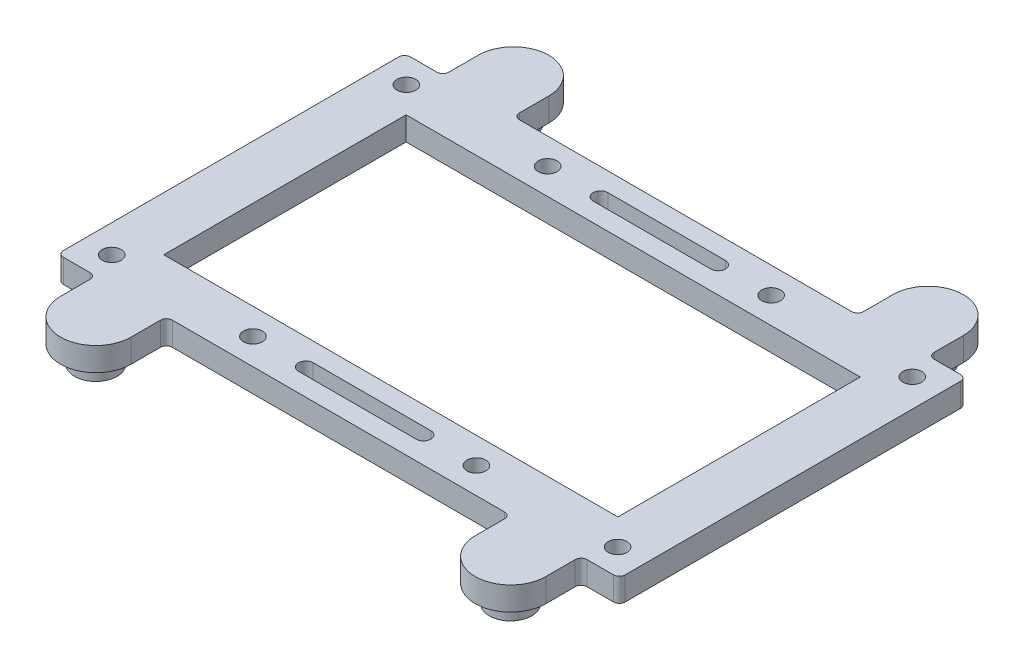
from build123d import *

# Parameters (mm, degrees)
EXTRUDE_1_DEPTH     = 4
SKETCH_4_R          = 3.6
EXTRUDE_2_DEPTH     = 3
EXTRUDE_2_2_DEPTH   = 3
EXTRUDE_2_3_DEPTH   = 3
EXTRUDE_2_4_DEPTH   = 3
SKETCH_5_R          = 1.8
EXTRUDE_3_DEPTH     = 1.3
EXTRUDE_3_2_DEPTH   = 1.3
EXTRUDE_3_3_DEPTH   = 1.3
EXTRUDE_3_4_DEPTH   = 1.3
SKETCH_10_W         = 77.2
SKETCH_10_H         = 41.2
CUT_EXTRUDE_5_DEPTH = 64.805975426
SKETCH_16_R         = 1.6
CUT_EXTRUDE_6_DEPTH = 10
FILLET_1_R          = 1


with BuildPart() as part:
    # 草图1 → 凸台-拉伸1 (new body)
    with BuildSketch(Plane(origin=(0, 0, 0), x_dir=(1, 0, 0), z_dir=(0, 1, 0))):
        with BuildLine():
            Line((-47.75, 29.5), (-41.25, 29.5))
            Line((-41.25, 29.5), (-41.25, 35.5))
            ThreePointArc((-41.25, 35.5), (-35.25, 41.5), (-29.25, 35.5))
            Line((-29.25, 35.5), (-29.25, 29.5))
            Line((-29.25, 29.5), (-3, 29.5))
            Line((-3, 29.5), (3.25, 29.5))
            Line((3.25, 29.5), (29.25, 29.5))
            Line((29.25, 29.5), (29.25, 35.5))
            ThreePointArc((29.25, 35.5), (35.25, 41.5), (41.25, 35.5))
            Line((41.25, 35.5), (41.25, 29.5))
            Line((41.25, 29.5), (47.75, 29.5))
            Line((47.75, 29.5), (47.75, -29.5))
            Line((47.75, -29.5), (41.25, -29.5))
            Line((41.25, -29.5), (41.25, -35.5))
            ThreePointArc((41.25, -35.5), (35.25, -41.5), (29.25, -35.5))
            Line((29.25, -35.5), (29.25, -29.5))
            Line((29.25, -29.5), (3.25, -29.5))
            Line((3.25, -29.5), (-3, -29.5))
            Line((-3, -29.5), (-29.25, -29.5))
            Line((-29.25, -29.5), (-29.25, -35.5))
            ThreePointArc((-29.25, -35.5), (-35.25, -41.5), (-41.25, -35.5))
            Line((-41.25, -35.5), (-41.25, -29.5))
            Line((-41.25, -29.5), (-47.75, -29.5))
            Line((-47.75, -29.5), (-47.75, 29.5))
        make_face()
    extrude(amount=-EXTRUDE_1_DEPTH)

    # 草图10 → 切除-拉伸5 (cut, through all)
    with BuildSketch(Plane(origin=(0, 0, 0), x_dir=(1, 0, 0), z_dir=(0, 1, 0))):
        Rectangle(SKETCH_10_W, SKETCH_10_H)
    extrude(amount=-CUT_EXTRUDE_5_DEPTH, mode=Mode.SUBTRACT)

    # 草图16 → 切除-拉伸6 (cut)
    with BuildSketch(Plane(origin=(0, 0, 0), x_dir=(1, 0, 0), z_dir=(0, 1, 0))):
        with Locations(Location((19, 25.05, 0), (0, 0, 270))):
            Circle(SKETCH_16_R)
        with Locations(Location((43, 25.05, 0), (0, 0, 270))):
            Circle(SKETCH_16_R)
        with Locations(Location((-43, 25.05, 0), (0, 0, 90))):
            Circle(SKETCH_16_R)
        with Locations(Location((-19, 25.05, 0), (0, 0, 90))):
            Circle(SKETCH_16_R)
        with Locations(Location((43, -25.05, 0), (0, 0, 90))):
            Circle(SKETCH_16_R)
        with Locations(Location((19, -25.05, 0), (0, 0, 90))):
            Circle(SKETCH_16_R)
        with Locations(Location((-19, -25.05, 0), (0, 0, 270))):
            Circle(SKETCH_16_R)
        with Locations(Location((-43, -25.05, 0), (0, 0, 270))):
            Circle(SKETCH_16_R)
        with BuildLine():
            Line((-10, 26.3), (10, 26.3))
            ThreePointArc((10, 26.3), (11.25, 25.05), (10, 23.8))
            Line((10, 23.8), (-10, 23.8))
            ThreePointArc((-10, 23.8), (-11.25, 25.05), (-10, 26.3))
        make_face()
        with BuildLine():
            Line((-10, -26.3), (10, -26.3))
            ThreePointArc((10, -26.3), (11.25, -25.05), (10, -23.8))
            Line((10, -23.8), (-10, -23.8))
            ThreePointArc((-10, -23.8), (-11.25, -25.05), (-10, -26.3))
        make_face()
    extrude(amount=-CUT_EXTRUDE_6_DEPTH, mode=Mode.SUBTRACT)

    # 圆角1
    fillet_1_edges = [part.edges().sort_by_distance(p)[0] for p in [
        (41.25, -2, 29.5),
        (29.25, -2, 29.5),
        (-29.25, -2, 29.5),
        (-41.25, -2, 29.5),
        (-47.75, -2, 29.5),
        (-47.75, -2, -29.5),
        (-41.25, -2, -29.5),
        (-29.25, -2, -29.5),
        (29.25, -2, -29.5),
        (41.25, -2, -29.5),
        (47.75, -2, -29.5),
        (47.75, -2, 29.5),
    ]]
    fillet(fillet_1_edges, radius=FILLET_1_R)


with BuildPart() as body_2:
    # 草图4 → 凸台-拉伸2 (new body)
    with BuildSketch(Plane.XZ.offset(4)):
        with Locations(Location((-35.25, 35.5, 0), (0, 0, 270))):
            Circle(SKETCH_4_R)
    extrude(amount=EXTRUDE_2_DEPTH)


with BuildPart() as body_3:
    # 草图4 → Extrude 2 2 (new body)
    with BuildSketch(Plane.XZ.offset(4)):
        with Locations(Location((-35.25, -35.5, 0), (0, 0, 90))):
            Circle(SKETCH_4_R)
    extrude(amount=EXTRUDE_2_2_DEPTH)


with BuildPart() as body_4:
    # 草图4 → Extrude 2 3 (new body)
    with BuildSketch(Plane.XZ.offset(4)):
        with Locations(Location((35.25, -35.5, 0), (0, 0, 270))):
            Circle(SKETCH_4_R)
    extrude(amount=EXTRUDE_2_3_DEPTH)


with BuildPart() as body_5:
    # 草图4 → Extrude 2 4 (new body)
    with BuildSketch(Plane.XZ.offset(4)):
        with Locations(Location((35.25, 35.5, 0), (0, 0, 90))):
            Circle(SKETCH_4_R)
    extrude(amount=EXTRUDE_2_4_DEPTH)


with BuildPart() as body_6:
    # 草图5 → 凸台-拉伸3 (new body)
    with BuildSketch(Plane.XZ.offset(7)):
        with Locations(Location((-35.25, 35.5, 0), (0, 0, 270))):
            Circle(SKETCH_5_R)
    extrude(amount=EXTRUDE_3_DEPTH)


with BuildPart() as body_7:
    # 草图5 → Extrude 3 2 (new body)
    with BuildSketch(Plane.XZ.offset(7)):
        with Locations(Location((-35.25, -35.5, 0), (0, 0, 90))):
            Circle(SKETCH_5_R)
    extrude(amount=EXTRUDE_3_2_DEPTH)


with BuildPart() as body_8:
    # 草图5 → Extrude 3 3 (new body)
    with BuildSketch(Plane.XZ.offset(7)):
        with Locations(Location((35.25, -35.5, 0), (0, 0, 270))):
            Circle(SKETCH_5_R)
    extrude(amount=EXTRUDE_3_3_DEPTH)


with BuildPart() as body_9:
    # 草图5 → Extrude 3 4 (new body)
    with BuildSketch(Plane.XZ.offset(7)):
        with Locations(Location((35.25, 35.5, 0), (0, 0, 90))):
            Circle(SKETCH_5_R)
    extrude(amount=EXTRUDE_3_4_DEPTH)


solid = Compound([part.part, body_2.part, body_3.part, body_4.part, body_5.part, body_6.part, body_7.part, body_8.part, body_9.part])
